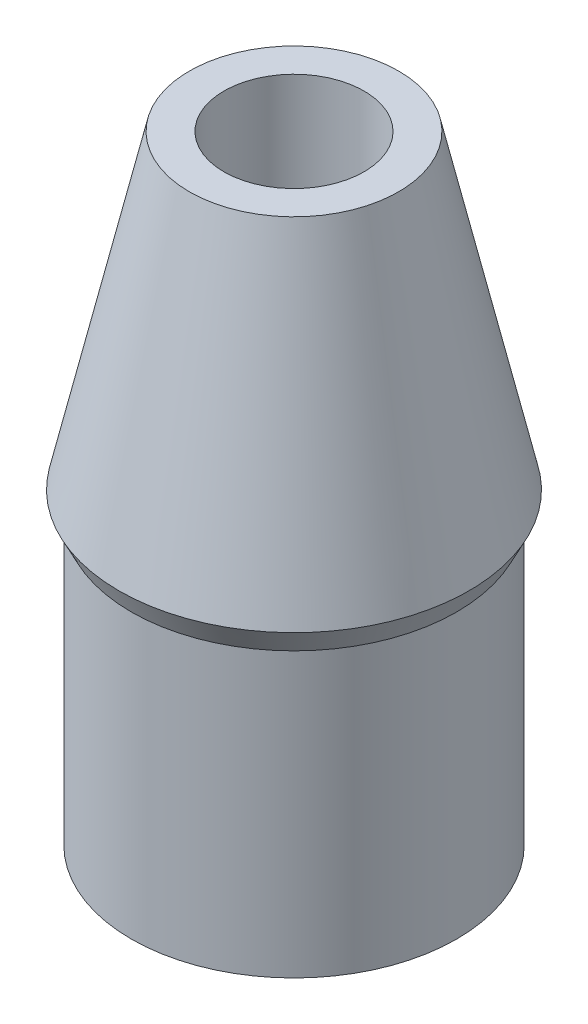
from build123d import *

# Parameters (mm, degrees)
F_5_16_24_TAPPED_HOLE2_D     = 6.9088
F_5_16_24_TAPPED_HOLE2_DEPTH = 21.1709
F_5_16_24_TAPPED_HOLE2_TIP   = 2.075612922


with BuildPart() as part:
    # Sketch3 → Revolve1 (revolve)
    with BuildSketch(Plane.XY, mode=Mode.PRIVATE) as revolve1_sk:
        Polygon((8.0264, -13.97), (0, -13.97), (0, 16.51), (5.159901878, 16.51), (8.630843425, 1.204032551), (8.0264, 0), align=None)
    revolve(revolve1_sk.sketch.rotate(Axis((0, 16.51, 0), (0, -1, 0)), 90), axis=Axis((0, 16.51, 0), (0, -1, 0)))

    # 5/16-24 Tapped Hole2
    with Locations(Plane(origin=(0, 16.51, 0), x_dir=(1, 0, 0), z_dir=(0, 1, 0))):
        with Locations((0, 0)):
            Hole(F_5_16_24_TAPPED_HOLE2_D / 2, depth=F_5_16_24_TAPPED_HOLE2_DEPTH)
            with Locations((0, 0, -(F_5_16_24_TAPPED_HOLE2_DEPTH + F_5_16_24_TAPPED_HOLE2_TIP / 2))):  # 118° drill point
                Cone(0, F_5_16_24_TAPPED_HOLE2_D / 2, F_5_16_24_TAPPED_HOLE2_TIP, mode=Mode.SUBTRACT)


solid = part.part
